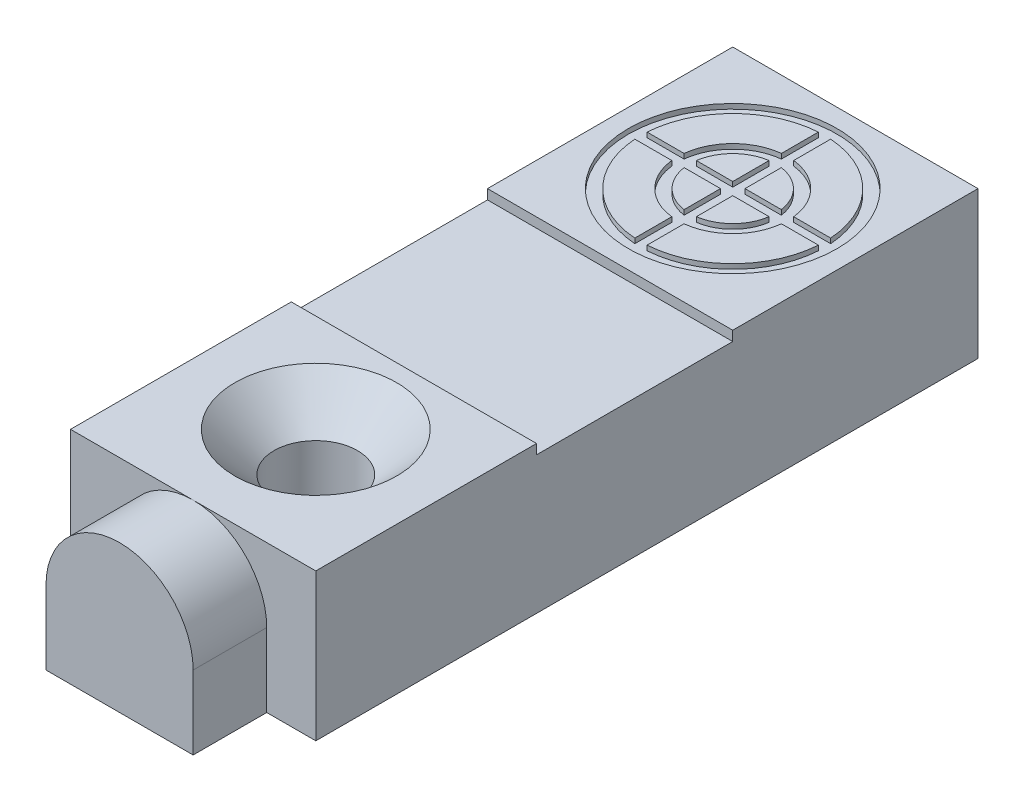
from build123d import *

# Parameters (mm, degrees)
SKETCH_1_W                = 10
SKETCH_1_H                = 27
SKETCH_1_R                = 1.5
EXTRUDE_1_DEPTH           = 6
SKETCH_2_R                = 4.25
SKETCH_2_R_2              = 3.75
SKETCH_2_R_3              = 2.25
SKETCH_2_R_4              = 1.75
SKETCH_2_W                = 8
SKETCH_2_H                = 0.5
SKETCH_2_W_2              = 0.5
SKETCH_2_H_2              = 8
CUT_EXTRUDE_1_DEPTH       = 0.2
SKETCH_3_W                = 10
SKETCH_3_H                = 8
CUT_EXTRUDE_1_2_DEPTH     = 0.4
HOLE_WIZARD_1_D           = 3.4
HOLE_WIZARD_1_DEPTH       = 22.25
HOLE_WIZARD_1_CSINK_D     = 6.6
HOLE_WIZARD_1_CSINK_ANGLE = 90
HOLE_WIZARD_1_TIP         = 1.021463052
EXTRUDE_2_DEPTH           = 3


with BuildPart() as part:
    # 草图1 → 凸台-拉伸1 (new body)
    with BuildSketch(Plane(origin=(0, 0, 0), x_dir=(1, 0, 0), z_dir=(0, 1, 0))):
        with Locations((5, 13.5)):
            Rectangle(SKETCH_1_W, SKETCH_1_H)
        with Locations(Location((5, 5, 0), (0, 0, 270))):
            Circle(SKETCH_1_R, mode=Mode.SUBTRACT)
    extrude(amount=EXTRUDE_1_DEPTH)

    # 草图2 → Cut-Extrude 1 (cut)
    # profile 1 of 4: a face of its own
    with BuildSketch(Plane(origin=(0, 6, 0), x_dir=(1, 0, 0), z_dir=(0, 1, 0))):
        with Locations((5, 22)):
            Circle(SKETCH_2_R)
        with Locations((5, 22)):
            Circle(SKETCH_2_R_2, mode=Mode.SUBTRACT)
    # profile 2 of 4: a face of its own
    with BuildSketch(Plane(origin=(0, 6, 0), x_dir=(1, 0, 0), z_dir=(0, 1, 0))):
        with Locations((5, 22)):
            Circle(SKETCH_2_R_3)
        with Locations((5, 22)):
            Circle(SKETCH_2_R_4, mode=Mode.SUBTRACT)
    # profile 3 of 4: a face of its own
    with BuildSketch(Plane(origin=(0, 6, 0), x_dir=(1, 0, 0), z_dir=(0, 1, 0))):
        with Locations((5, 22)):
            Rectangle(SKETCH_2_W, SKETCH_2_H)
    # profile 4 of 4: a face of its own
    with BuildSketch(Plane(origin=(0, 6, 0), x_dir=(1, 0, 0), z_dir=(0, 1, 0))):
        with Locations((5, 22)):
            Rectangle(SKETCH_2_W_2, SKETCH_2_H_2)
    extrude(amount=-CUT_EXTRUDE_1_DEPTH, mode=Mode.SUBTRACT)

    # 草图3 → Cut-Extrude 1 2 (cut)
    with BuildSketch(Plane(origin=(0, 6, 0), x_dir=(1, 0, 0), z_dir=(0, 1, 0))):
        with Locations((5, 13)):
            Rectangle(SKETCH_3_W, SKETCH_3_H)
    extrude(amount=-CUT_EXTRUDE_1_2_DEPTH, mode=Mode.SUBTRACT)

    # 打孔尺寸(%根据十字)槽半沉头木螺钉的类型1
    with Locations(Plane(origin=(0, 6, 0), x_dir=(1, 0, 0), z_dir=(0, 1, 0))):
        with Locations((5, 5)):
            CounterSinkHole(HOLE_WIZARD_1_D / 2, HOLE_WIZARD_1_CSINK_D / 2, depth=HOLE_WIZARD_1_DEPTH, counter_sink_angle=HOLE_WIZARD_1_CSINK_ANGLE)
            with Locations((0, 0, -(HOLE_WIZARD_1_DEPTH + HOLE_WIZARD_1_TIP / 2))):  # 118° drill point
                Cone(0, HOLE_WIZARD_1_D / 2, HOLE_WIZARD_1_TIP, mode=Mode.SUBTRACT)

    # 草图6 → 凸台-拉伸2 (add)
    with BuildSketch(Plane.XY):
        with BuildLine():
            Line((2, 3), (2, 0))
            Line((2, 0), (8, 0))
            Line((8, 0), (8, 3))
            ThreePointArc((8, 3), (5, 6), (2, 3))
        make_face()
    extrude(amount=EXTRUDE_2_DEPTH)


solid = part.part
